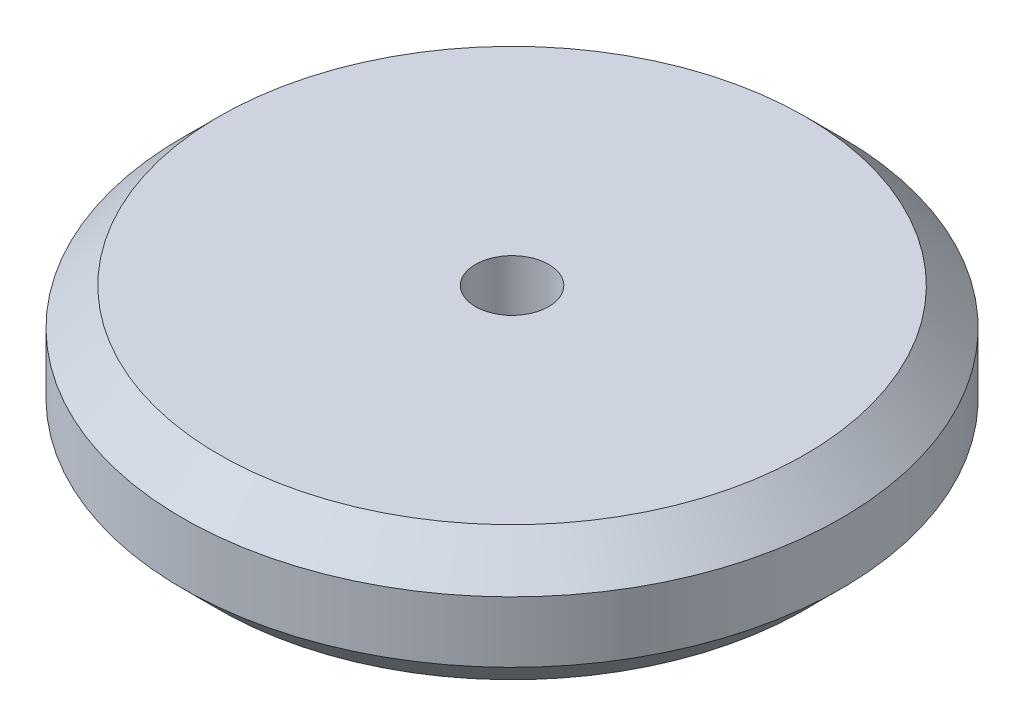
from build123d import *

# Parameters (mm, degrees)
SKETCH2_R          = 1.65
CUT_EXTRUDE1_DEPTH = 42.797129088


with BuildPart() as part:
    # Sketch1 → Revolve1 (revolve)
    with BuildSketch(Plane.XY, mode=Mode.PRIVATE) as revolve1_sk:
        Polygon((10, 0), (10, 6), (24, 6), (27, 9), (27, 14), (24, 17), (3, 17), (3, 0), align=None)
    revolve(revolve1_sk.sketch.rotate(Axis((0, 0, 0), (0, 1, 0)), 90), axis=Axis((0, 0, 0), (0, 1, 0)))

    # Sketch2 → Cut-Extrude1 (cut, through all)
    with BuildSketch(Plane.XY):
        with Locations(Location((0, 3, 0), (0, 0, 90))):
            Circle(SKETCH2_R)
    extrude(amount=-CUT_EXTRUDE1_DEPTH, mode=Mode.SUBTRACT)


solid = part.part
